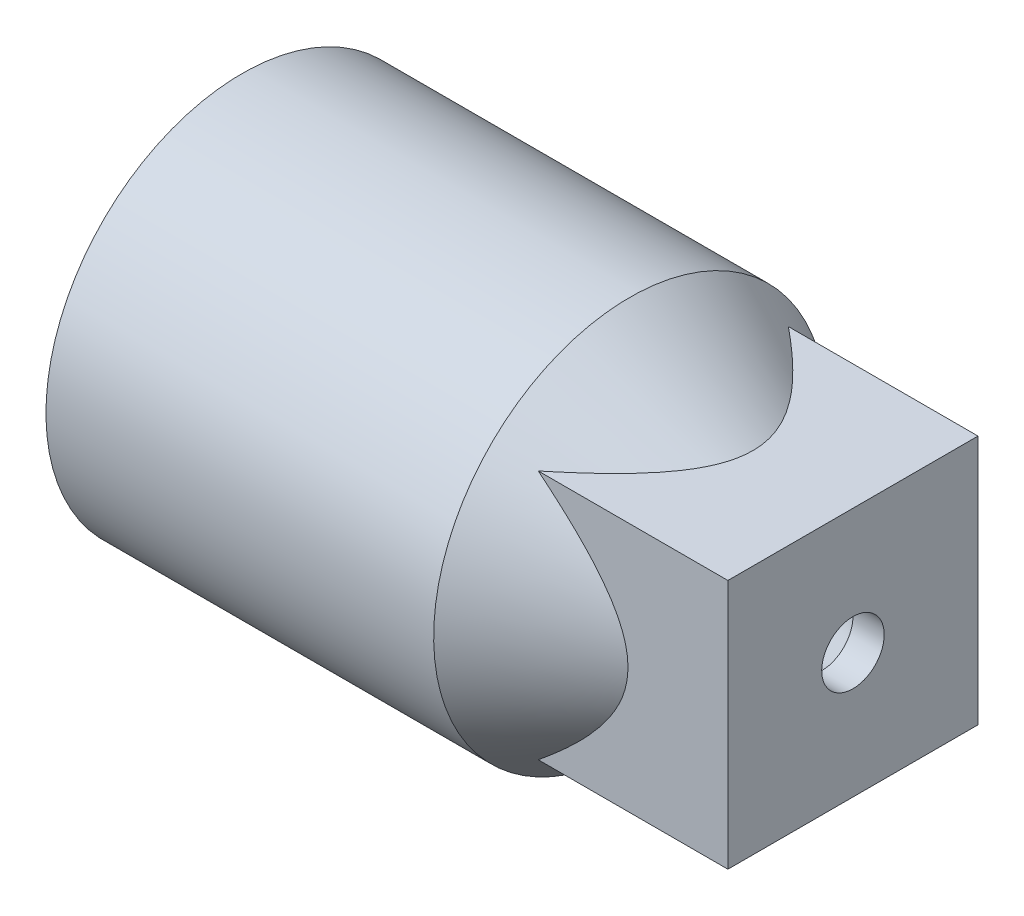
from build123d import *

# Parameters (mm, degrees)
CHAFL_N1_SIZE                       = 1.5
CROQUIS3_W                          = 16
CROQUIS3_H                          = 16
CROQUIS3_R                          = 2
SALIENTE_EXTRUIR1_DEPTH             = 2
SALIENTE_EXTRUIR1_DIRECTION_2_REACH = 43.106


with BuildPart() as part:
    # Croquis1 → Revolución1 (revolve)
    with BuildSketch(Plane.XY, mode=Mode.PRIVATE) as revoluci_n1_sk:
        Polygon((0, 9.55), (24, 9.55), (37.076983597, 2), (37.076983597, 5.464101615), (24.803847577, 12.55), (0, 12.55), align=None)
    revolve(revoluci_n1_sk.sketch.rotate(Axis((0, 0, 0), (1, 0, 0)), 180), axis=Axis((0, 0, 0), (1, 0, 0)))

    # Chaflán1
    chafl_n1_edges = [part.edges().sort_by_distance(p)[0] for p in [
        (0, 9.55, 0),
    ]]
    chamfer(chafl_n1_edges, length=CHAFL_N1_SIZE)

    # Croquis3 → Saliente-Extruir1 (add)
    with BuildSketch(Plane(origin=(37.076983597, 0, 0), x_dir=(0, 0, -1), z_dir=(1, 0, 0))):
        Rectangle(CROQUIS3_W, CROQUIS3_H)
        with Locations(Location((0, 0, 0), (0, 0, 270))):
            Circle(CROQUIS3_R, mode=Mode.SUBTRACT)
    extrude(amount=SALIENTE_EXTRUIR1_DEPTH)

    # Croquis3 → Saliente-Extruir1 direction 2 (add, up to next)
    with BuildSketch(Plane(origin=(37.076983597, 0, 0), x_dir=(0, 0, -1), z_dir=(1, 0, 0)), mode=Mode.PRIVATE) as saliente_extruir1_direction_2_sk1:
        Rectangle(CROQUIS3_W, CROQUIS3_H)
        with Locations(Location((0, 0, 0), (0, 0, 270))):
            Circle(CROQUIS3_R, mode=Mode.SUBTRACT)
    saliente_extruir1_direction_2_tool1 = extrude(saliente_extruir1_direction_2_sk1.sketch, amount=-SALIENTE_EXTRUIR1_DIRECTION_2_REACH, mode=Mode.PRIVATE) - part.part
    add(saliente_extruir1_direction_2_tool1.solids().sort_by_distance((37.076984, -7.773726, 0))[0])


solid = part.part
